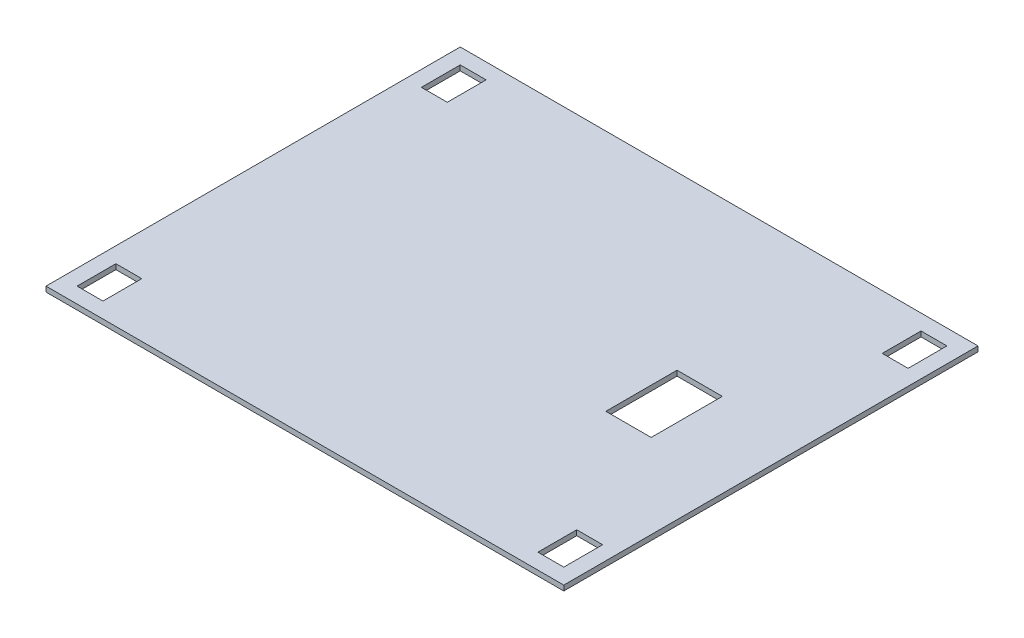
from build123d import *

# Parameters (mm, degrees)
SKETCH1_W           = 127
SKETCH1_H           = 101.6
BOSS_EXTRUDE1_DEPTH = 1.27
CUT_EXTRUDE1_REACH  = 83.33
SKETCH2_W           = 6.35
SKETCH2_H           = 9.525
CUT_EXTRUDE2_REACH  = 83.33
SKETCH3_W           = 11.1125
SKETCH3_H           = 17.4625


with BuildPart() as part:
    # Sketch1 → Boss-Extrude1 (new body)
    with BuildSketch(Plane(origin=(0, 0, 0), x_dir=(1, 0, 0), z_dir=(0, 1, 0))):
        Rectangle(SKETCH1_W, SKETCH1_H)
    extrude(amount=BOSS_EXTRUDE1_DEPTH)

    # Sketch2 → Cut-Extrude1 (cut, up to next)
    with BuildSketch(Plane(origin=(0, 1.27, 0), x_dir=(1, 0, 0), z_dir=(0, 1, 0)), mode=Mode.PRIVATE) as cut_extrude1_sk1:
        with Locations((-56.515, 42.2275)):
            Rectangle(SKETCH2_W, SKETCH2_H)
    cut_extrude1_tool1 = extrude(cut_extrude1_sk1.sketch, amount=-CUT_EXTRUDE1_REACH, mode=Mode.PRIVATE) & part.part
    # Sketch2 → Cut-Extrude1 (cut, up to next)
    with BuildSketch(Plane(origin=(0, 1.27, 0), x_dir=(1, 0, 0), z_dir=(0, 1, 0)), mode=Mode.PRIVATE) as cut_extrude1_sk2:
        with Locations((56.515, 42.2275)):
            Rectangle(SKETCH2_W, SKETCH2_H)
    cut_extrude1_tool2 = extrude(cut_extrude1_sk2.sketch, amount=-CUT_EXTRUDE1_REACH, mode=Mode.PRIVATE) & part.part
    # Sketch2 → Cut-Extrude1 (cut, up to next)
    with BuildSketch(Plane(origin=(0, 1.27, 0), x_dir=(1, 0, 0), z_dir=(0, 1, 0)), mode=Mode.PRIVATE) as cut_extrude1_sk3:
        with Locations((56.515, -42.2275)):
            Rectangle(SKETCH2_W, SKETCH2_H)
    cut_extrude1_tool3 = extrude(cut_extrude1_sk3.sketch, amount=-CUT_EXTRUDE1_REACH, mode=Mode.PRIVATE) & part.part
    # Sketch2 → Cut-Extrude1 (cut, up to next)
    with BuildSketch(Plane(origin=(0, 1.27, 0), x_dir=(1, 0, 0), z_dir=(0, 1, 0)), mode=Mode.PRIVATE) as cut_extrude1_sk4:
        with Locations((-56.515, -42.2275)):
            Rectangle(SKETCH2_W, SKETCH2_H)
    cut_extrude1_tool4 = extrude(cut_extrude1_sk4.sketch, amount=-CUT_EXTRUDE1_REACH, mode=Mode.PRIVATE) & part.part
    add(cut_extrude1_tool1.solids().sort_by_distance((-56.515, 1.27, -42.2275))[0], mode=Mode.SUBTRACT)
    add(cut_extrude1_tool2.solids().sort_by_distance((56.515, 1.27, -42.2275))[0], mode=Mode.SUBTRACT)
    add(cut_extrude1_tool3.solids().sort_by_distance((56.515, 1.27, 42.2275))[0], mode=Mode.SUBTRACT)
    add(cut_extrude1_tool4.solids().sort_by_distance((-56.515, 1.27, 42.2275))[0], mode=Mode.SUBTRACT)

    # Sketch3 → Cut-Extrude2 (cut, up to next)
    with BuildSketch(Plane(origin=(0, 1.27, 0), x_dir=(1, 0, 0), z_dir=(0, 1, 0)), mode=Mode.PRIVATE) as cut_extrude2_sk1:
        with Locations((37.30625, 0)):
            Rectangle(SKETCH3_W, SKETCH3_H)
    cut_extrude2_tool1 = extrude(cut_extrude2_sk1.sketch, amount=-CUT_EXTRUDE2_REACH, mode=Mode.PRIVATE) & part.part
    add(cut_extrude2_tool1.solids().sort_by_distance((37.30625, 1.27, 0))[0], mode=Mode.SUBTRACT)


solid = part.part
